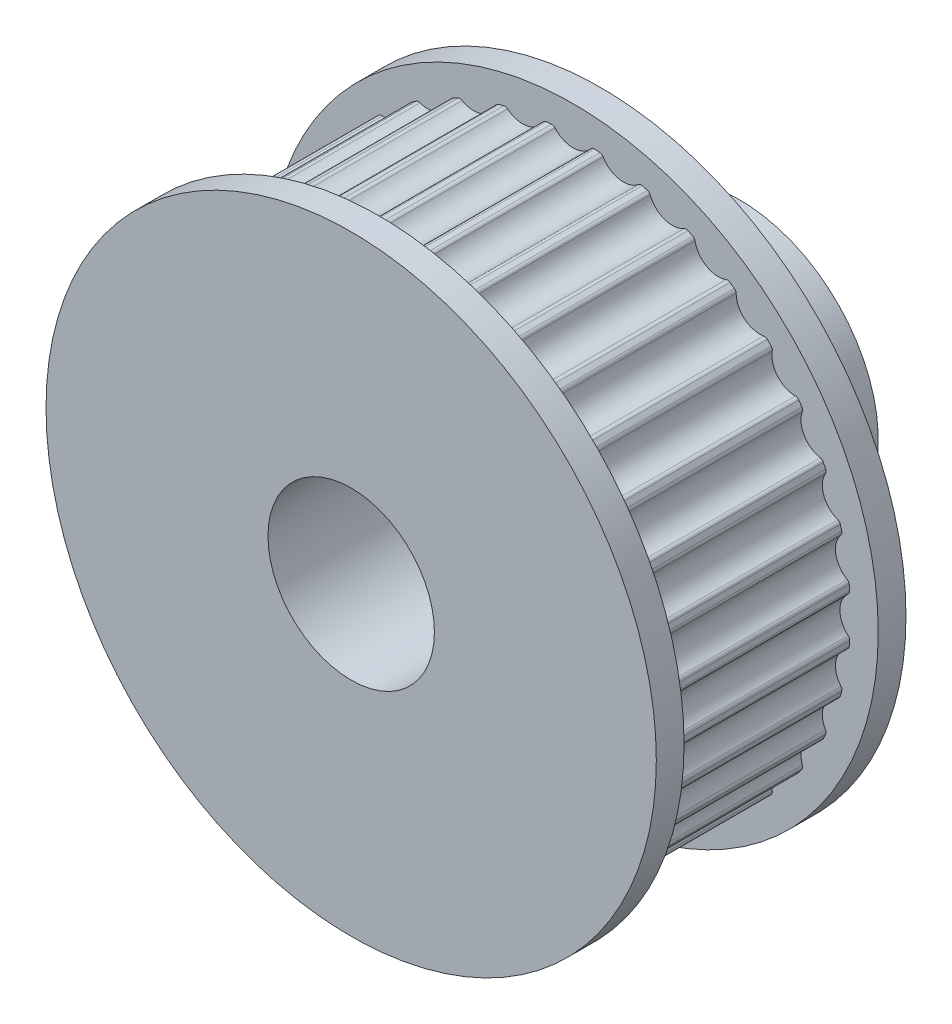
from build123d import *

# Parameters (mm, degrees)
IZIM1_R                        = 10
IZIM1_R_2                      = 3
Y_KSEKLIK_EKSTR_ZYON1_DEPTH    = 7
KES_EKSTR_ZYON2_START          = -7
KES_EKSTR_ZYON2_DEPTH          = 7
RADYUS2_R                      = 0.15
DAIRESEL_KAPLAMA2_COUNT        = 36
RADYUS2_OF_DAIRESEL_KAPLAMA2_R = 0.15
IZIM4_R                        = 11
IZIM4_R_2                      = 3
Y_KSEKLIK_EKSTR_ZYON2_DEPTH    = 1
Y_KSEKLIK_EKSTR_ZYON4_START    = 1
IZIM5_R                        = 11
Y_KSEKLIK_EKSTR_ZYON4_DEPTH    = 1
EXTRUDE_START                  = 5
SKETCH_1_R                     = 5
SKETCH_1_R_2                   = 3
EXTRUDE_1_DEPTH                = 5
SKETCH_2_R                     = 3
CUT_EXTRUDE_1_DEPTH            = 5
CUT_EXTRUDE_2_REACH            = 27.02
CUT_EXTRUDE_2_END_RADIUS       = 3
IZIM6_R                        = 1.5
CUT_EXTRUDE_3_REACH            = 27.02
CUT_EXTRUDE_3_END_RADIUS       = 3
SKETCH_3_R                     = 1.5


with BuildPart() as part:
    # Çizim1 → Yükseklik-Ekstrüzyon1 (new body)
    with BuildSketch(Plane.XY):
        Circle(IZIM1_R)
        Circle(IZIM1_R_2, mode=Mode.SUBTRACT)
    extrude(amount=Y_KSEKLIK_EKSTR_ZYON1_DEPTH)

    # Çizim2 → Kes-Ekstrüzyon2 (cut)
    with BuildSketch(Plane.XY.offset(7).offset(KES_EKSTR_ZYON2_START)):
        with BuildLine():
            ThreePointArc((-0.694317247, 9.975867058), (0, 9.617020387), (0.694317247, 9.975867058))
            ThreePointArc((0.694317247, 9.975867058), (0, 10), (-0.694317247, 9.975867058))
        make_face()
    kes_ekstr_zyon2 = extrude(amount=KES_EKSTR_ZYON2_DEPTH, mode=Mode.SUBTRACT)

    # Radyus2
    radyus2_edges = [part.edges().sort_by_distance(p)[0] for p in [
        (0.694317247, 9.975867058, 3.5),
        (-0.694317247, 9.975867058, 3.5),
    ]]
    fillet(radyus2_edges, radius=RADYUS2_R)

    # Dairesel Kaplama2: Kes-Ekstrüzyon2 ×36 about axis
    dairesel_kaplama2_axis = Axis((0, 0, 0), (0, 0, 1))
    for i in range(1, DAIRESEL_KAPLAMA2_COUNT):
        add(kes_ekstr_zyon2.rotate(dairesel_kaplama2_axis, i * 360 / DAIRESEL_KAPLAMA2_COUNT), mode=Mode.SUBTRACT)

    # Radyus2 of Dairesel Kaplama2
    radyus2_of_dairesel_kaplama2_edges = [part.edges().sort_by_distance(p)[0] for p in [
        (-1.048522128, 9.944878146, 3.5),
        (-2.416060143, 9.703744297, 3.5),
        (-2.759502688, 9.611719145, 3.5),
        (-4.064392274, 9.136778176, 3.5),
        (-4.386637155, 8.98651292, 3.5),
        (-5.589229903, 8.292195674, 3.5),
        (-5.880485872, 8.088256049, 3.5),
        (-6.944241609, 7.195659002, 3.5),
        (-7.195659002, 6.944241609, 3.5),
        (-8.088256049, 5.880485872, 3.5),
        (-8.292195674, 5.589229903, 3.5),
        (-8.98651292, 4.386637155, 3.5),
        (-9.136778176, 4.064392274, 3.5),
        (-9.611719145, 2.759502688, 3.5),
        (-9.703744297, 2.416060143, 3.5),
        (-9.944878146, 1.048522128, 3.5),
        (-9.975867058, 0.694317247, 3.5),
        (-9.975867058, -0.694317247, 3.5),
        (-9.944878146, -1.048522128, 3.5),
        (-9.703744297, -2.416060143, 3.5),
        (-9.611719145, -2.759502688, 3.5),
        (-9.136778176, -4.064392274, 3.5),
        (-8.98651292, -4.386637155, 3.5),
        (-8.292195674, -5.589229903, 3.5),
        (-8.088256049, -5.880485872, 3.5),
        (-7.195659002, -6.944241609, 3.5),
        (-6.944241609, -7.195659002, 3.5),
        (-5.880485872, -8.088256049, 3.5),
        (-5.589229903, -8.292195674, 3.5),
        (-4.386637155, -8.98651292, 3.5),
        (-4.064392274, -9.136778176, 3.5),
        (-2.759502688, -9.611719145, 3.5),
        (-2.416060143, -9.703744297, 3.5),
        (-1.048522128, -9.944878146, 3.5),
        (-0.694317247, -9.975867058, 3.5),
        (0.694317247, -9.975867058, 3.5),
        (1.048522128, -9.944878146, 3.5),
        (2.416060143, -9.703744297, 3.5),
        (2.759502688, -9.611719145, 3.5),
        (4.064392274, -9.136778176, 3.5),
        (4.386637155, -8.98651292, 3.5),
        (5.589229903, -8.292195674, 3.5),
        (5.880485872, -8.088256049, 3.5),
        (6.944241609, -7.195659002, 3.5),
        (7.195659002, -6.944241609, 3.5),
        (8.088256049, -5.880485872, 3.5),
        (8.292195674, -5.589229903, 3.5),
        (8.98651292, -4.386637155, 3.5),
        (9.136778176, -4.064392274, 3.5),
        (9.611719145, -2.759502688, 3.5),
        (9.703744297, -2.416060143, 3.5),
        (9.944878146, -1.048522128, 3.5),
        (9.975867058, -0.694317247, 3.5),
        (9.975867058, 0.694317247, 3.5),
        (9.944878146, 1.048522128, 3.5),
        (9.703744297, 2.416060143, 3.5),
        (9.611719145, 2.759502688, 3.5),
        (9.136778176, 4.064392274, 3.5),
        (8.98651292, 4.386637155, 3.5),
        (8.292195674, 5.589229903, 3.5),
        (8.088256049, 5.880485872, 3.5),
        (7.195659002, 6.944241609, 3.5),
        (6.944241609, 7.195659002, 3.5),
        (5.880485872, 8.088256049, 3.5),
        (5.589229903, 8.292195674, 3.5),
        (4.386637155, 8.98651292, 3.5),
        (4.064392274, 9.136778176, 3.5),
        (2.759502688, 9.611719145, 3.5),
        (2.416060143, 9.703744297, 3.5),
        (1.048522128, 9.944878146, 3.5),
    ]]
    fillet(radyus2_of_dairesel_kaplama2_edges, radius=RADYUS2_OF_DAIRESEL_KAPLAMA2_R)

    # Çizim4 → Yükseklik-Ekstrüzyon2 (add)
    with BuildSketch(Plane.XY.offset(7)):
        Circle(IZIM4_R)
        Circle(IZIM4_R_2, mode=Mode.SUBTRACT)
    extrude(amount=Y_KSEKLIK_EKSTR_ZYON2_DEPTH)

    # Çizim5 → Yükseklik-Ekstrüzyon4 (add)
    with BuildSketch(Plane(origin=(0, 0, 0), x_dir=(-1, 0, 0), z_dir=(0, 0, -1)).offset(Y_KSEKLIK_EKSTR_ZYON4_START)):
        with Locations(Location((0, 0, 0), (0, 0, 180))):
            Circle(IZIM5_R)
    extrude(amount=-Y_KSEKLIK_EKSTR_ZYON4_DEPTH)

    # 草圖1 → 填料-伸長1 (add)
    with BuildSketch(Plane(origin=(0, 0, -1), x_dir=(-1, 0, 0), z_dir=(0, 0, -1)).offset(EXTRUDE_START)):
        Circle(SKETCH_1_R)
        with Locations(Location((0, 0, 0), (0, 0, 180))):
            Circle(SKETCH_1_R_2, mode=Mode.SUBTRACT)
    extrude(amount=-EXTRUDE_1_DEPTH)

    # 草圖2 → 除料-伸長1 (cut)
    with BuildSketch(Plane(origin=(0, 0, -1), x_dir=(-1, 0, 0), z_dir=(0, 0, -1))):
        Circle(SKETCH_2_R)
    extrude(amount=-CUT_EXTRUDE_1_DEPTH, mode=Mode.SUBTRACT)

    # 除料-伸長2: up to this cylinder (the profile starts outside it)
    cut_extrude_2_end = Plane(origin=(0, 0, -3.5), z_dir=(0, 0, -1)) * Cylinder(CUT_EXTRUDE_2_END_RADIUS, 61.04, mode=Mode.PRIVATE)
    # Çizim6 → 除料-伸長2 (cut, up to the surface)
    with BuildSketch(Plane(origin=(0, 10, 0), x_dir=(1, 0, 0), z_dir=(0, 1, 0)), mode=Mode.PRIVATE) as cut_extrude_2_sk1:
        with Locations(Location((0, 3.5, 0), (0, 0, 270))):
            Circle(IZIM6_R)
    cut_extrude_2_tool1 = extrude(cut_extrude_2_sk1.sketch, amount=-CUT_EXTRUDE_2_REACH, mode=Mode.PRIVATE) - cut_extrude_2_end
    add(cut_extrude_2_tool1.solids().sort_by_distance((0, 10, -3.5))[0], mode=Mode.SUBTRACT)

    # 除料-伸長3: up to this cylinder (the profile starts outside it)
    cut_extrude_3_end = Plane(origin=(0, 0, -3.5), z_dir=(0, 0, -1)) * Cylinder(CUT_EXTRUDE_3_END_RADIUS, 61.04, mode=Mode.PRIVATE)
    # 草圖3 → 除料-伸長3 (cut, up to the surface)
    with BuildSketch(Plane(origin=(10, 0, 0), x_dir=(0, 0, -1), z_dir=(1, 0, 0)), mode=Mode.PRIVATE) as cut_extrude_3_sk1:
        with Locations((3.5, 0)):
            Circle(SKETCH_3_R)
    cut_extrude_3_tool1 = extrude(cut_extrude_3_sk1.sketch, amount=-CUT_EXTRUDE_3_REACH, mode=Mode.PRIVATE) - cut_extrude_3_end
    add(cut_extrude_3_tool1.solids().sort_by_distance((10, 0, -3.5))[0], mode=Mode.SUBTRACT)


solid = part.part
